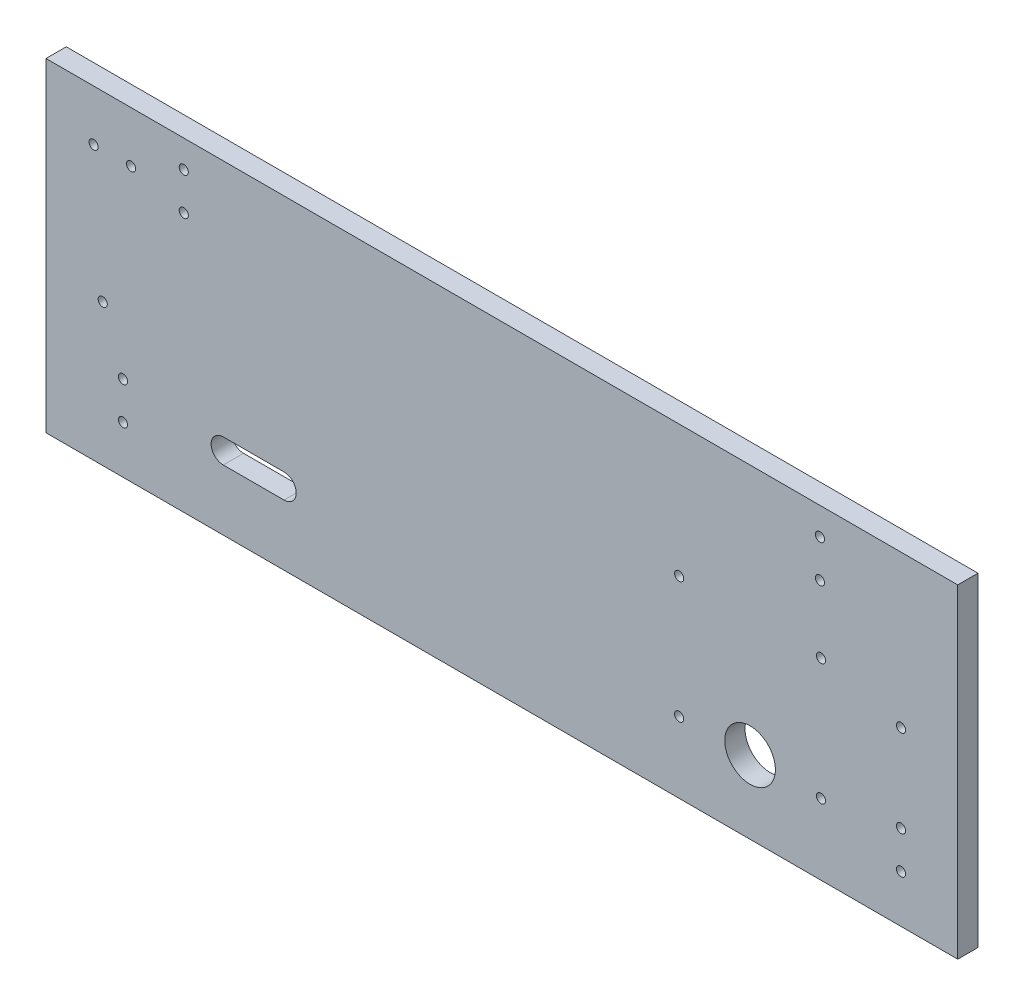
from build123d import *

# Parameters (mm, degrees)
SCHIZZO1_W                   = 450
SCHIZZO1_H                   = 160
ESTRUSIONE_ESTRUSIONE1_DEPTH = 10
SCHIZZO2_R                   = 12.5
SCHIZZO2_R_2                 = 2.25
TAGLIO_ESTRUSIONE1_DEPTH     = 10


with BuildPart() as part:
    # Schizzo1 → Estrusione-Estrusione1 (new body)
    with BuildSketch(Plane.XY):
        with Locations((225, 80)):
            Rectangle(SCHIZZO1_W, SCHIZZO1_H)
    extrude(amount=ESTRUSIONE_ESTRUSIONE1_DEPTH)

    # Schizzo2 → Taglio-Estrusione1 (cut)
    with BuildSketch(Plane.XY.offset(10)):
        with Locations((347.5, 36)):
            Circle(SCHIZZO2_R)
        with Locations((68, 146.5)):
            Circle(SCHIZZO2_R_2)
        with Locations((68, 128)):
            Circle(SCHIZZO2_R_2)
        with Locations((382, 146.5)):
            Circle(SCHIZZO2_R_2)
        with Locations((382, 128)):
            Circle(SCHIZZO2_R_2)
        with Locations((38, 42)):
            Circle(SCHIZZO2_R_2)
        with Locations((38, 23.5)):
            Circle(SCHIZZO2_R_2)
        with Locations((422, 42)):
            Circle(SCHIZZO2_R_2)
        with Locations((422, 23.5)):
            Circle(SCHIZZO2_R_2)
        with Locations((23.5, 134.933694222)):
            Circle(SCHIZZO2_R_2)
        with Locations((42, 134.933694222)):
            Circle(SCHIZZO2_R_2)
        with Locations((28, 70)):
            Circle(SCHIZZO2_R_2)
        with Locations((422, 85)):
            Circle(SCHIZZO2_R_2)
        with Locations((312.5, 95)):
            Circle(SCHIZZO2_R_2)
        with Locations((382.5, 95)):
            Circle(SCHIZZO2_R_2)
        with Locations((382.5, 35)):
            Circle(SCHIZZO2_R_2)
        with Locations((312.5, 35)):
            Circle(SCHIZZO2_R_2)
        with BuildLine():
            Line((87.5, 42), (117.5, 42))
            ThreePointArc((117.5, 42), (123.5, 36), (117.5, 30))
            Line((117.5, 30), (87.5, 30))
            ThreePointArc((87.5, 30), (81.5, 36), (87.5, 42))
        make_face()
    extrude(amount=-TAGLIO_ESTRUSIONE1_DEPTH, mode=Mode.SUBTRACT)


solid = part.part
